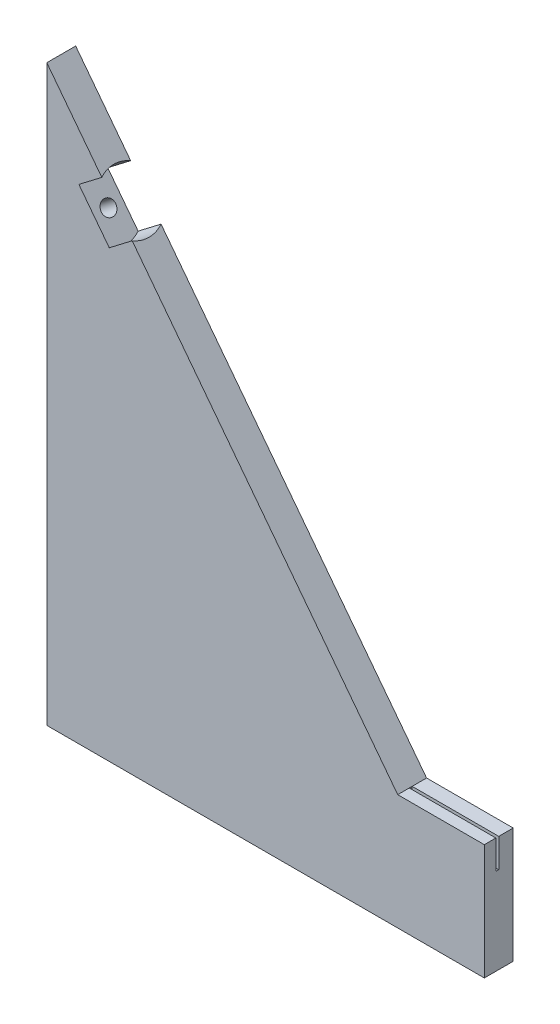
from build123d import *

# Parameters (mm, degrees)
EXTRUDE1_DEPTH = 6.35
SKETCH3_R      = 1.5875
EXTRUDE2_DEPTH = 12.7
SKETCH4_R      = 1.5875
EXTRUDE3_DEPTH = 12.7
SKETCH6_W      = 19.05
SKETCH6_H      = 0.635
EXTRUDE4_DEPTH = 6.35
SKETCH8_R      = 6.35
EXTRUDE5_DEPTH = 6.35


with BuildPart() as part:
    # Sketch1 → Extrude1 (new body)
    with BuildSketch(Plane.XY):
        Polygon((-15.437909459, 32.870050856), (-15.437909459, -93.380203425), (61.751637834, -93.380203425), (80.801637834, -93.380203425), (80.801637834, -67.980203425), (61.751637834, -67.980203425), align=None)
    extrude(amount=EXTRUDE1_DEPTH)

    # Sketch3 → Extrude2 (cut)
    with BuildSketch(Plane.XZ.offset(93.380203425)):
        with Locations(Location((-8.098362166, 3.175, 0), (0, 0, 270))):
            Circle(SKETCH3_R)
        with Locations(Location((68.101637834, 3.175, 0), (0, 0, 270))):
            Circle(SKETCH3_R)
    extrude(amount=-EXTRUDE2_DEPTH, mode=Mode.SUBTRACT)

    # Sketch4 → Extrude3 (cut)
    with BuildSketch(Plane(origin=(6.12959486, 4.691516702, 0), x_dir=(0, 0, -1), z_dir=(0.7940964904073088, 0.6077917109691402, 0))):
        with Locations(Location((-3.175, 10.085025428, 0), (0, 0, 90))):
            Circle(SKETCH4_R)
    extrude(amount=-EXTRUDE3_DEPTH, mode=Mode.SUBTRACT)

    # Sketch6 → Extrude4 (cut)
    with BuildSketch(Plane(origin=(0, -67.980203425, 0), x_dir=(1, 0, 0), z_dir=(0, 1, 0))):
        with Locations((71.276637834, -3.4925)):
            Rectangle(SKETCH6_W, SKETCH6_H)
    extrude(amount=-EXTRUDE4_DEPTH, mode=Mode.SUBTRACT)

    # Sketch8 → Extrude5 (cut)
    with BuildSketch(Plane(origin=(6.12959486, 4.691516702, 0), x_dir=(0, 0, -1), z_dir=(0.7940964904073088, 0.6077917109691404, 0))):
        with Locations((-3.175, 10.085025428)):
            Circle(SKETCH8_R)
    extrude(amount=-EXTRUDE5_DEPTH, mode=Mode.SUBTRACT)


solid = part.part
